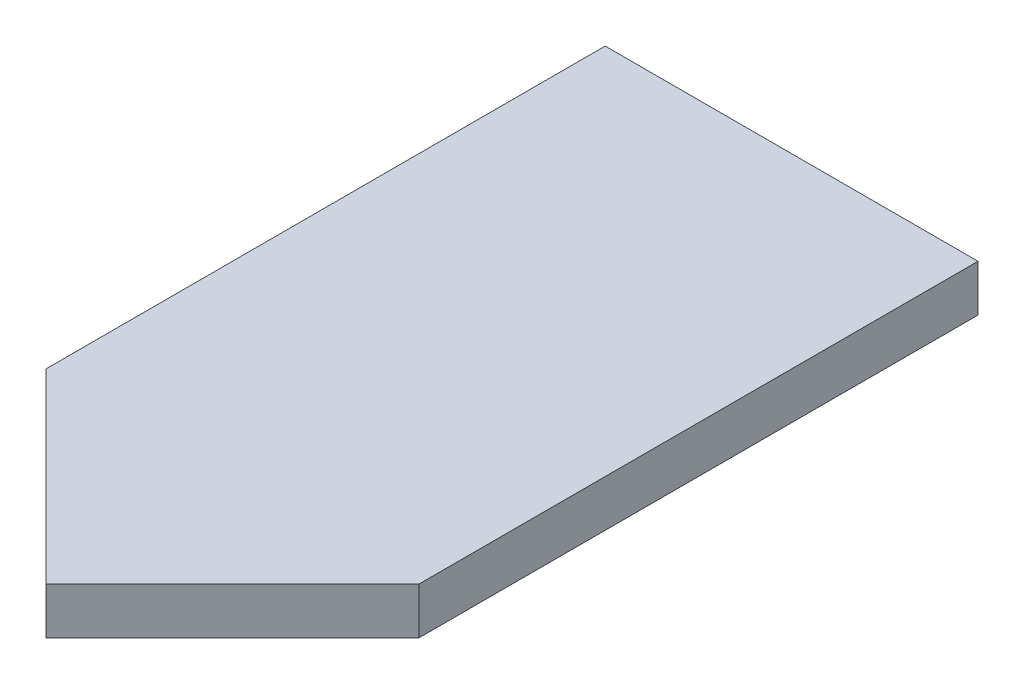
from build123d import *

# Parameters (mm, degrees)
BOSS_EXTRUDE1_DEPTH = 1.5875


with BuildPart() as part:
    # Sketch2 → Boss-Extrude1 (new body)
    with BuildSketch(Plane(origin=(0, 0, 0), x_dir=(1, 0, 0), z_dir=(0, 1, 0))):
        Polygon((-6.35, 0), (6.35, 0), (6.35, -19.05), (0, -25.4), (-6.35, -19.05), align=None)
    extrude(amount=BOSS_EXTRUDE1_DEPTH)


solid = part.part
